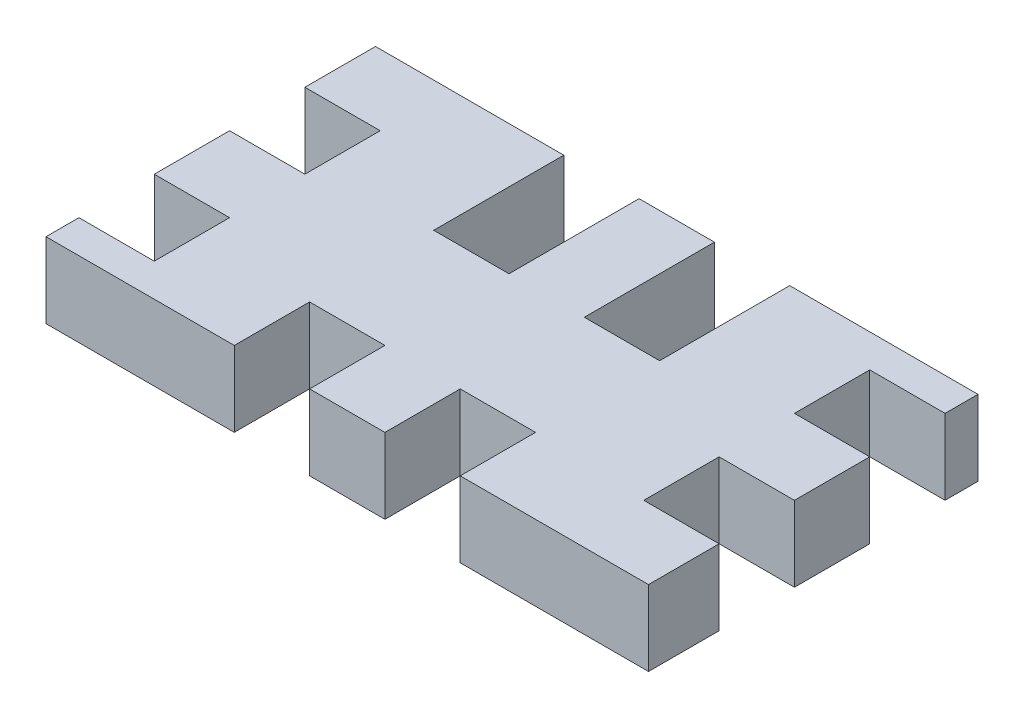
from build123d import *

# Parameters (mm, degrees)
EXTRUDE_1_DEPTH = 16


with BuildPart() as part:
    # 草图1 → 凸台-拉伸1 (new body)
    with BuildSketch(Plane(origin=(0, 0, 0), x_dir=(1, 0, 0), z_dir=(0, 1, 0))):
        Polygon((-43.925242433, 7.748839376), (-43.925242433, -8.251160624), (-27.925242433, -8.251160624), (-27.925242433, -24.251160624), (-43.925242433, -24.251160624), (-43.925242433, -31.251160624), (-3.925242433, -31.251160624), (-3.925242433, -15.251160624), (12.074757567, -15.251160624), (12.074757567, -31.251160624), (28.074757567, -31.251160624), (28.074757567, -15.251160624), (44.074757567, -15.251160624), (44.074757567, -31.251160624), (84.074757567, -31.251160624), (84.074757567, -16.251160624), (68.074757567, -16.251160624), (68.074757567, -0.251160624), (84.074757567, -0.251160624), (84.074757567, 15.748839376), (68.074757567, 15.748839376), (68.074757567, 31.748839376), (84.074757567, 31.748839376), (84.074757567, 38.748839376), (44.074757567, 38.748839376), (44.074757567, 11.111523777), (28.074757567, 11.111523777), (28.074757567, 38.748839376), (12.074757567, 38.748839376), (12.074757567, 11.111523777), (-3.925242433, 11.111523777), (-3.925242433, 38.748839376), (-43.925242433, 38.748839376), (-43.925242433, 23.748839376), (-27.925242433, 23.748839376), (-27.925242433, 7.748839376), align=None)
    extrude(amount=EXTRUDE_1_DEPTH)


solid = part.part
